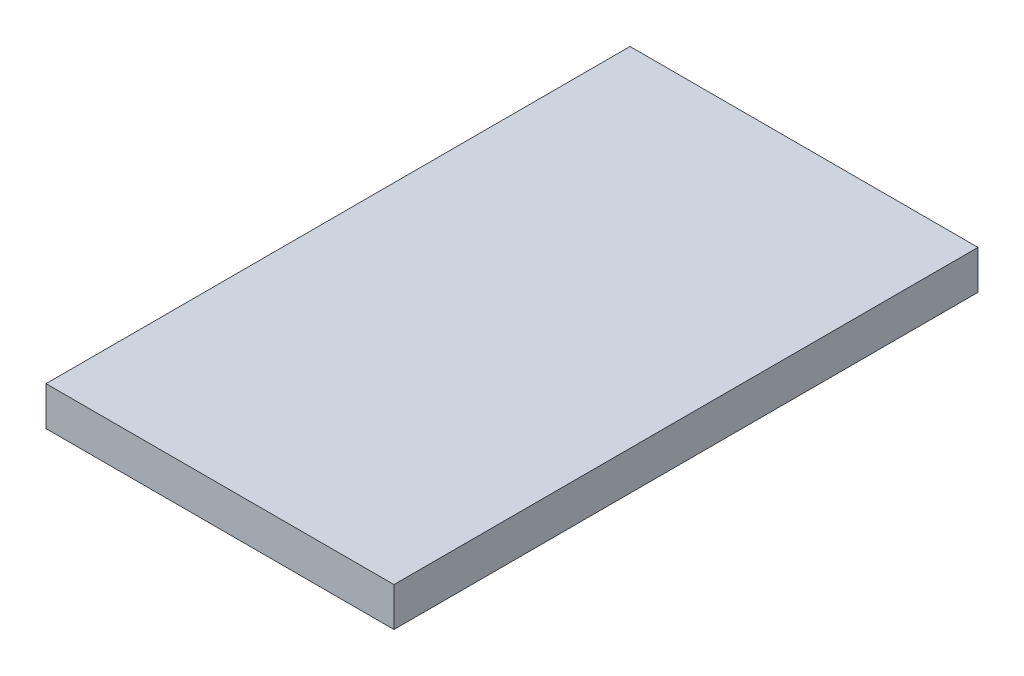
from build123d import *

# Parameters (mm, degrees)
SKETCH1_W           = 181.61
SKETCH1_H           = 304.8
BOSS_EXTRUDE1_DEPTH = 20.32


with BuildPart() as part:
    # Sketch1 → Boss-Extrude1 (new body)
    with BuildSketch(Plane(origin=(0, 0, 0), x_dir=(1, 0, 0), z_dir=(0, 1, 0))):
        with Locations((44.419500362, 97.914345948)):
            Rectangle(SKETCH1_W, SKETCH1_H)
    extrude(amount=BOSS_EXTRUDE1_DEPTH)


solid = part.part
